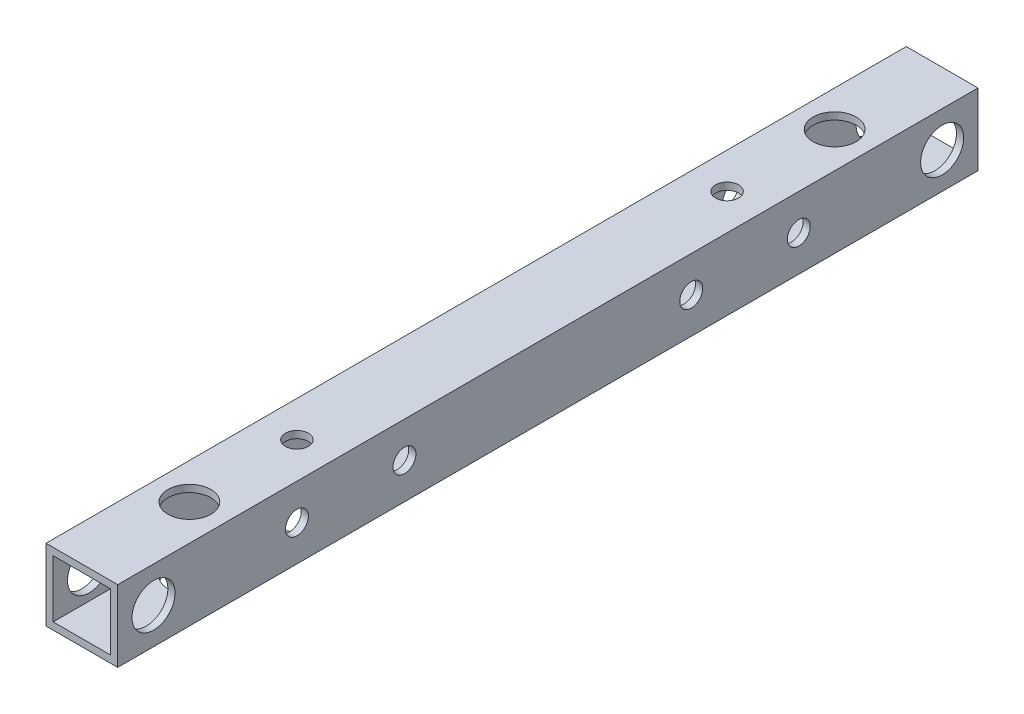
from build123d import *

# Parameters (mm, degrees)
SKETCH_1_W          = 10
SKETCH_1_H          = 10
SKETCH_1_W_2        = 8
SKETCH_1_H_2        = 8
EXTRUDE_1_DEPTH     = 120
SKETCH_2_R          = 3
CUT_EXTRUDE_1_DEPTH = 121.519707932
SKETCH_3_R          = 3
CUT_EXTRUDE_2_DEPTH = 10
SKETCH_4_R          = 1.6
CUT_EXTRUDE_3_DEPTH = 10
SKETCH_5_R          = 1.6
CUT_EXTRUDE_4_DEPTH = 121.519707932
SKETCH_6_R          = 3
CUT_EXTRUDE_5_DEPTH = 2
SKETCH_7_R          = 1.6
CUT_EXTRUDE_6_DEPTH = 121.519707932


with BuildPart() as part:
    # ｽｹｯﾁ1 → ﾎﾞｽ - 押し出し1 (new body)
    with BuildSketch(Plane.XY):
        Rectangle(SKETCH_1_W, SKETCH_1_H)
        Rectangle(SKETCH_1_W_2, SKETCH_1_H_2, mode=Mode.SUBTRACT)
    extrude(amount=EXTRUDE_1_DEPTH)

    # ｽｹｯﾁ2 → ｶｯﾄ - 押し出し1 (cut, through all)
    with BuildSketch(Plane.ZY.offset(5)):
        with Locations((5, 0)):
            Circle(SKETCH_2_R)
        with Locations((115, 0)):
            Circle(SKETCH_2_R)
    extrude(amount=-CUT_EXTRUDE_1_DEPTH, mode=Mode.SUBTRACT)

    # ｽｹｯﾁ3 → ｶｯﾄ - 押し出し2 (cut)
    with BuildSketch(Plane(origin=(0, 5, 0), x_dir=(1, 0, 0), z_dir=(0, 1, 0))):
        with Locations(Location((0, -105, 0), (0, 0, 270))):
            Circle(SKETCH_3_R)
        with Locations(Location((0, -15, 0), (0, 0, 270))):
            Circle(SKETCH_3_R)
    extrude(amount=-CUT_EXTRUDE_2_DEPTH, mode=Mode.SUBTRACT)

    # ｽｹｯﾁ4 → ｶｯﾄ - 押し出し3 (cut)
    with BuildSketch(Plane(origin=(0, 5, 0), x_dir=(1, 0, 0), z_dir=(0, 1, 0))):
        with Locations(Location((0, -30, 0), (0, 0, 270))):
            Circle(SKETCH_4_R)
        with Locations(Location((0, -90, 0), (0, 0, 270))):
            Circle(SKETCH_4_R)
    extrude(amount=-CUT_EXTRUDE_3_DEPTH, mode=Mode.SUBTRACT)

    # ｽｹｯﾁ5 → ｶｯﾄ - 押し出し4 (cut, through all)
    with BuildSketch(Plane.ZY.offset(5)):
        with Locations((25, 0)):
            Circle(SKETCH_5_R)
        with Locations((95, 0)):
            Circle(SKETCH_5_R)
    extrude(amount=-CUT_EXTRUDE_4_DEPTH, mode=Mode.SUBTRACT)

    # ｽｹｯﾁ6 → ｶｯﾄ - 押し出し5 (cut)
    with BuildSketch(Plane(origin=(0, -5, 0), x_dir=(-1, 0, 0), z_dir=(0, -1, 0))):
        with Locations(Location((0, -30, 0), (0, 0, 90))):
            Circle(SKETCH_6_R)
        with Locations(Location((0, -90, 0), (0, 0, 90))):
            Circle(SKETCH_6_R)
    extrude(amount=-CUT_EXTRUDE_5_DEPTH, mode=Mode.SUBTRACT)

    # ｽｹｯﾁ7 → ｶｯﾄ - 押し出し6 (cut, through all)
    with BuildSketch(Plane.ZY.offset(5)):
        with Locations((80, 0)):
            Circle(SKETCH_7_R)
        with Locations((40, 0)):
            Circle(SKETCH_7_R)
    extrude(amount=-CUT_EXTRUDE_6_DEPTH, mode=Mode.SUBTRACT)


solid = part.part
